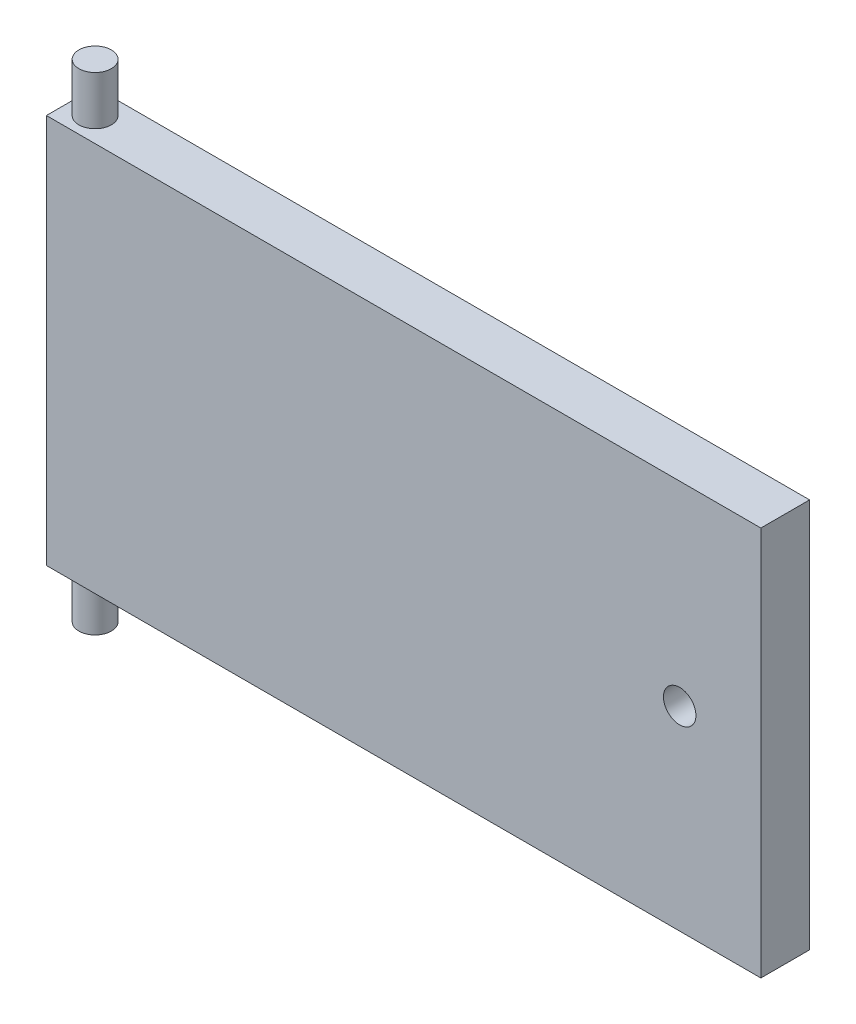
from build123d import *

# Parameters (mm, degrees)
SKETCH1_W                = 220
SKETCH1_H                = 120
BOSS_EXTRUDE1_DEPTH      = 15
BOSS_EXTRUDE2_DEPTH      = 15
BOSS_EXTRUDE2_DEPTH_BACK = 135
SKETCH2_R                = 5
SKETCH3_R                = 5
CUT_EXTRUDE1_DEPTH       = 25


with BuildPart() as part:
    # Sketch1 → Boss-Extrude1 (new body)
    with BuildSketch(Plane.XY):
        with Locations((110, -60)):
            Rectangle(SKETCH1_W, SKETCH1_H)
    extrude(amount=BOSS_EXTRUDE1_DEPTH)

    # Sketch2 → Boss-Extrude2 (add, two sides: drawn at the far end of the back side and taken through both)
    with BuildSketch(Plane(origin=(0, 0, 0), x_dir=(1, 0, 0), z_dir=(0, 1, 0)).offset(-BOSS_EXTRUDE2_DEPTH_BACK)):
        with Locations(Location((7.5, -7.5, 0), (0, 0, 270))):
            Circle(SKETCH2_R)
    extrude(amount=BOSS_EXTRUDE2_DEPTH + BOSS_EXTRUDE2_DEPTH_BACK)

    # Sketch3 → Cut-Extrude1 (cut)
    with BuildSketch(Plane.XY.offset(15)):
        with Locations((195, -60)):
            Circle(SKETCH3_R)
    extrude(amount=-CUT_EXTRUDE1_DEPTH, mode=Mode.SUBTRACT)


solid = part.part
